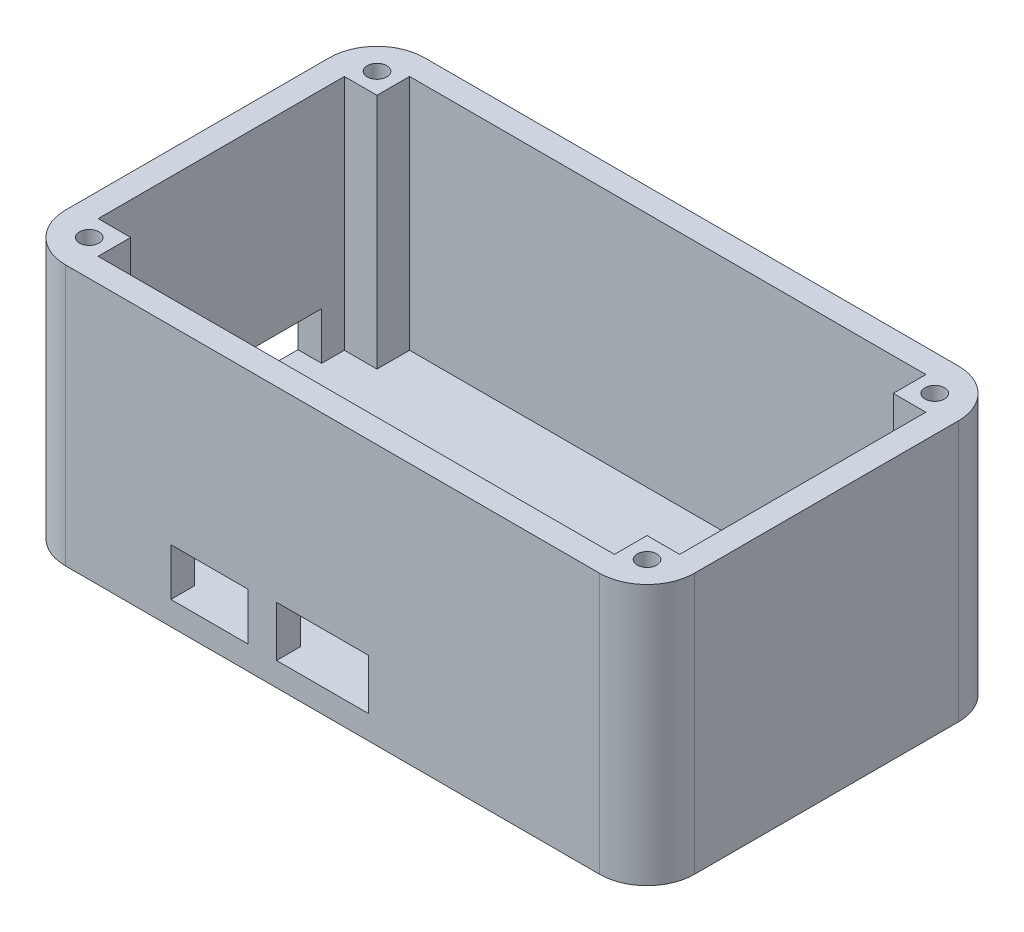
from build123d import *
from build123d.topology import SkipClean

# Parameters (mm, degrees)
SKETCH1_R           = 1.65
BOSS_EXTRUDE1_DEPTH = 40
BOSS_EXTRUDE2_START = 4
SKETCH2_R           = 1.65
BOSS_EXTRUDE2_DEPTH = 4
SKETCH3_W           = 15.5
SKETCH3_H           = 8.5
CUT_EXTRUDE1_DEPTH  = 4
SKETCH5_W           = 13
SKETCH5_H           = 8
CUT_EXTRUDE2_DEPTH  = 4
SKETCH6_W           = 13
SKETCH6_H           = 8
CUT_EXTRUDE3_DEPTH  = 4


with BuildPart() as part:
    # Sketch1 → Boss-Extrude1 (new body)
    with BuildSketch(Plane(origin=(0, 0, 0), x_dir=(1, 0, 0), z_dir=(0, 1, 0))):
        with BuildLine():
            Line((2, 54.54), (92.1, 54.54))
            ThreePointArc((92.1, 54.54), (97.756854249, 52.196854249), (100.1, 46.54))
            Line((100.1, 46.54), (100.1, 2))
            ThreePointArc((100.1, 2), (97.756854249, -3.656854249), (92.1, -6))
            Line((92.1, -6), (2, -6))
            ThreePointArc((2, -6), (-3.656854249, -3.656854249), (-6, 2))
            Line((-6, 2), (-6, 46.54))
            ThreePointArc((-6, 46.54), (-3.656854249, 52.196854249), (2, 54.54))
        make_face()
        with Locations(Location((0, 48.54, 0), (0, 0, 270))):
            Circle(SKETCH1_R, mode=Mode.SUBTRACT)
        with Locations(Location((0, 0, 0), (0, 0, 270))):
            Circle(SKETCH1_R, mode=Mode.SUBTRACT)
        with Locations(Location((94.1, 48.54, 0), (0, 0, 270))):
            Circle(SKETCH1_R, mode=Mode.SUBTRACT)
        with Locations(Location((94.1, 0, 0), (0, 0, 270))):
            Circle(SKETCH1_R, mode=Mode.SUBTRACT)
        Polygon((-2, 45.04), (3.5, 45.04), (3.5, 50.54), (90.6, 50.54), (90.6, 45.04), (96.1, 45.04), (96.1, 3.5), (90.6, 3.5), (90.6, -2), (3.5, -2), (3.5, 3.5), (-2, 3.5), align=None, mode=Mode.SUBTRACT)
    extrude(amount=BOSS_EXTRUDE1_DEPTH)

    # Sketch2 → Boss-Extrude2 (add)
    with SkipClean():  # the faces are left unmerged after this step: merging them gives an invalid solid
        with BuildSketch(Plane.XZ.offset(BOSS_EXTRUDE2_START)):
            with BuildLine():
                Line((100.1, -46.54), (100.1, -2))
                ThreePointArc((100.1, -2), (97.756854249, 3.656854249), (92.1, 6))
                Line((92.1, 6), (2, 6))
                ThreePointArc((2, 6), (-3.656854249, 3.656854249), (-6, -2))
                Line((-6, -2), (-6, -46.54))
                ThreePointArc((-6, -46.54), (-3.656854249, -52.196854249), (2, -54.54))
                Line((2, -54.54), (92.1, -54.54))
                ThreePointArc((92.1, -54.54), (97.756854249, -52.196854249), (100.1, -46.54))
            make_face()
            with Locations(Location((94.1, 0, 0), (0, 0, 270))):
                Circle(SKETCH2_R, mode=Mode.SUBTRACT)
            with Locations(Location((94.1, -48.54, 0), (0, 0, 270))):
                Circle(SKETCH2_R, mode=Mode.SUBTRACT)
            with Locations(Location((0, -48.54, 0), (0, 0, 270))):
                Circle(SKETCH2_R, mode=Mode.SUBTRACT)
            with Locations(Location((0, 0, 0), (0, 0, 270))):
                Circle(SKETCH2_R, mode=Mode.SUBTRACT)
        extrude(amount=-BOSS_EXTRUDE2_DEPTH)

    # Sketch3 → Cut-Extrude1 (cut)
    with SkipClean():  # the faces are left unmerged after this step: merging them gives an invalid solid
        with BuildSketch(Plane.XY.offset(6)):
            with Locations((45.353986939, 4.25)):
                Rectangle(SKETCH3_W, SKETCH3_H)
        extrude(amount=-CUT_EXTRUDE1_DEPTH, mode=Mode.SUBTRACT)

    # Sketch5 → Cut-Extrude2 (cut)
    with SkipClean():  # the faces are left unmerged after this step: merging them gives an invalid solid
        with BuildSketch(Plane.ZY.offset(6)):
            with Locations((-34.712384261, 4)):
                Rectangle(SKETCH5_W, SKETCH5_H)
        extrude(amount=-CUT_EXTRUDE2_DEPTH, mode=Mode.SUBTRACT)

    # Sketch6 → Cut-Extrude3 (cut)
    with SkipClean():  # the faces are left unmerged after this step: merging them gives an invalid solid
        with BuildSketch(Plane.XY.offset(6)):
            with Locations((26.272328528, 4)):
                Rectangle(SKETCH6_W, SKETCH6_H)
        extrude(amount=-CUT_EXTRUDE3_DEPTH, mode=Mode.SUBTRACT)


solid = part.part
